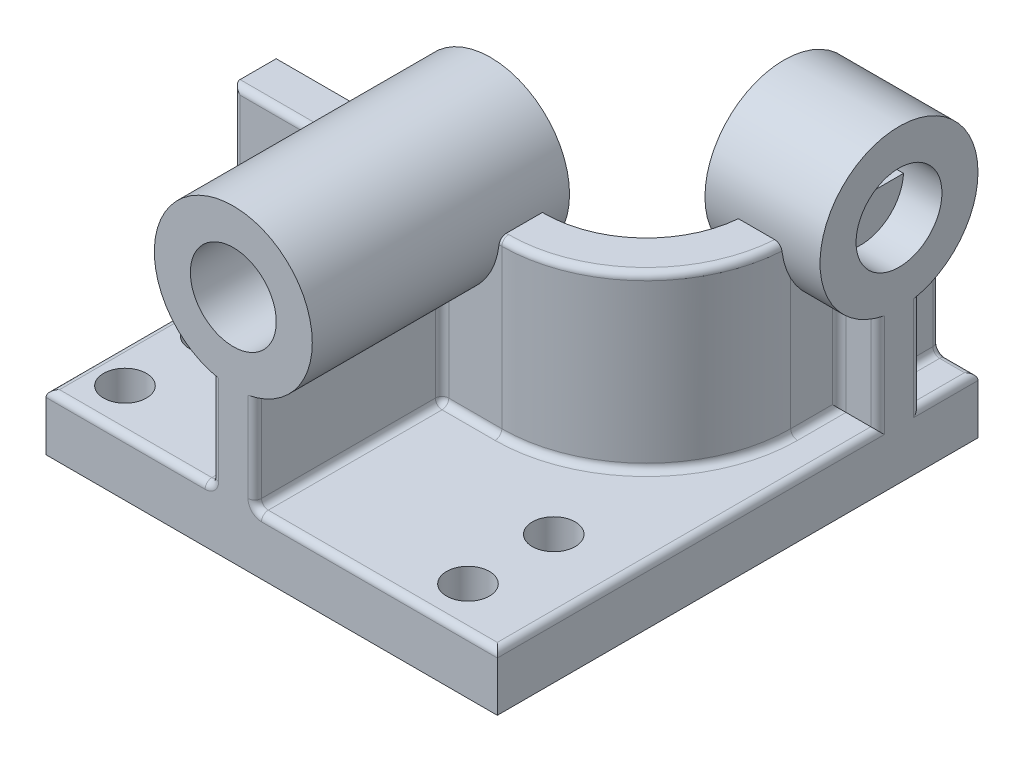
from build123d import *

# Parameters (mm, degrees)
SKETCH1_W           = 200
SKETCH1_H           = 213
SKETCH1_R           = 9.5
BOSS_EXTRUDE1_DEPTH = 25
SKETCH2_R           = 35
SKETCH2_R_2         = 19.03
BOSS_EXTRUDE2_DEPTH = 114
SKETCH3_R           = 35
SKETCH3_R_2         = 19.03
BOSS_EXTRUDE3_DEPTH = 51
CUT_EXTRUDE1_DEPTH  = 51
BOSS_EXTRUDE4_START = 76
BOSS_EXTRUDE4_DEPTH = 76
SKETCH5_W           = 19
SKETCH5_H           = 46.369491486
BOSS_EXTRUDE5_DEPTH = 17
BOSS_EXTRUDE6_START = -83
SKETCH6_W           = 19
SKETCH6_H           = 46.471332412
BOSS_EXTRUDE6_DEPTH = 83
FILLET3_R           = 3


with BuildPart() as part:
    # Sketch1 → Boss-Extrude1 (new body)
    with BuildSketch(Plane(origin=(0, 0, 0), x_dir=(1, 0, 0), z_dir=(0, 1, 0))):
        Rectangle(SKETCH1_W, SKETCH1_H)
        with Locations(Location((68, -49.5, 0), (0, 0, 270))):
            Circle(SKETCH1_R, mode=Mode.SUBTRACT)
        with Locations(Location((68, -87.5, 0), (0, 0, 270))):
            Circle(SKETCH1_R, mode=Mode.SUBTRACT)
        with Locations(Location((-84, -49.5, 0), (0, 0, 270))):
            Circle(SKETCH1_R, mode=Mode.SUBTRACT)
        with Locations(Location((-84, -87.5, 0), (0, 0, 270))):
            Circle(SKETCH1_R, mode=Mode.SUBTRACT)
    extrude(amount=BOSS_EXTRUDE1_DEPTH)

    # Sketch4 → Cut-Extrude1 (cut)
    with BuildSketch(Plane(origin=(0, 25, 0), x_dir=(1, 0, 0), z_dir=(0, 1, 0))):
        with BuildLine():
            Line((-100, 106.5), (-100, -4.5))
            Line((-100, -4.5), (19, -4.5))
            ThreePointArc((19, -4.5), (50.819805153, 8.680194847), (64, 40.5))
            Line((64, 40.5), (64, 106.5))
            Line((64, 106.5), (-100, 106.5))
        make_face()
    extrude(amount=-CUT_EXTRUDE1_DEPTH, mode=Mode.SUBTRACT)



with BuildPart() as body_2:
    # Sketch2 → Boss-Extrude2 (new body)
    with BuildSketch(Plane.XY.offset(106.5)):
        with Locations((-17, 102)):
            Circle(SKETCH2_R)
        with Locations((-17, 102)):
            Circle(SKETCH2_R_2, mode=Mode.SUBTRACT)
    extrude(amount=-BOSS_EXTRUDE2_DEPTH)


with BuildPart() as body_3:
    # Sketch3 → Boss-Extrude3 (new body)
    with BuildSketch(Plane(origin=(100, 0, 0), x_dir=(0, 0, -1), z_dir=(1, 0, 0))):
        with Locations((71.5, 102)):
            Circle(SKETCH3_R)
        with Locations((71.5, 102)):
            Circle(SKETCH3_R_2, mode=Mode.SUBTRACT)
    extrude(amount=-BOSS_EXTRUDE3_DEPTH)


with BuildPart() as part_1:
    add(part.part)

    add(body_2.part)  # Boss-Extrude4 merges body 2

    add(body_3.part)  # Boss-Extrude4 merges body 3
    # Sketch4<3> → Boss-Extrude4 (add)
    with BuildSketch(Plane(origin=(0, 25, 0), x_dir=(1, 0, 0), z_dir=(0, 1, 0)).offset(BOSS_EXTRUDE4_START)):
        with BuildLine():
            Line((-100, -4.5), (-100, -23.5))
            Line((-100, -23.5), (19, -23.5))
            ThreePointArc((19, -23.5), (64.254833996, -4.754833996), (83, 40.5))
            Line((83, 40.5), (83, 106.5))
            Line((83, 106.5), (64, 106.5))
            Line((64, 106.5), (64, 40.5))
            ThreePointArc((64, 40.5), (50.819805153, 8.680194847), (19, -4.5))
            Line((19, -4.5), (-100, -4.5))
        make_face()
    extrude(amount=-BOSS_EXTRUDE4_DEPTH)

    # Sketch5 → Boss-Extrude5 (add)
    with BuildSketch(Plane(origin=(100, 0, 0), x_dir=(0, 0, -1), z_dir=(1, 0, 0))):
        with Locations((71.5, 48.184745743)):
            Rectangle(SKETCH5_W, SKETCH5_H)
    extrude(amount=-BOSS_EXTRUDE5_DEPTH)

    # Sketch6 → Boss-Extrude6 (add)
    with BuildSketch(Plane.XY.offset(106.5).offset(BOSS_EXTRUDE6_START)):
        with Locations((-17, 48.235666206)):
            Rectangle(SKETCH6_W, SKETCH6_H)
    extrude(amount=BOSS_EXTRUDE6_DEPTH)

    # Fillet3
    fillet3_edges = [part_1.edges().sort_by_distance(p)[0] for p in [
        (83, 63, -106.5),
        (-7.5, 46.656974737, 106.5),
        (-26.5, 46.656974737, 106.5),
        (-100, 25, 65),
        (18.492855685, 101, 23.5),
        (83, 25, -51.25),
        (5.75, 25, 23.5),
        (100, 25, -93.75),
        (91.5, 25, -106.5),
        (83, 25, -93.75),
        (83, 46.656974737, -81),
        (100, 46.656974737, -81),
        (100, 46.656974737, -62),
        (83, 46.656974737, -62),
        (62.82302176, 101, 6.142713941),
        (64.254833996, 25, 4.754833996),
        (100, 25, 22.25),
        (46.25, 25, 106.5),
        (-7.5, 46.656974737, 23.5),
        (-7.5, 25, 65),
        (-63.25, 25, 106.5),
        (-63.25, 25, 23.5),
        (-26.5, 25, 65),
        (-26.5, 46.656974737, 23.5),
        (-100, 63, 23.5),
        (-75.992855685, 101, 23.5),
    ]]
    fillet(fillet3_edges, radius=FILLET3_R)


solid = part_1.part
